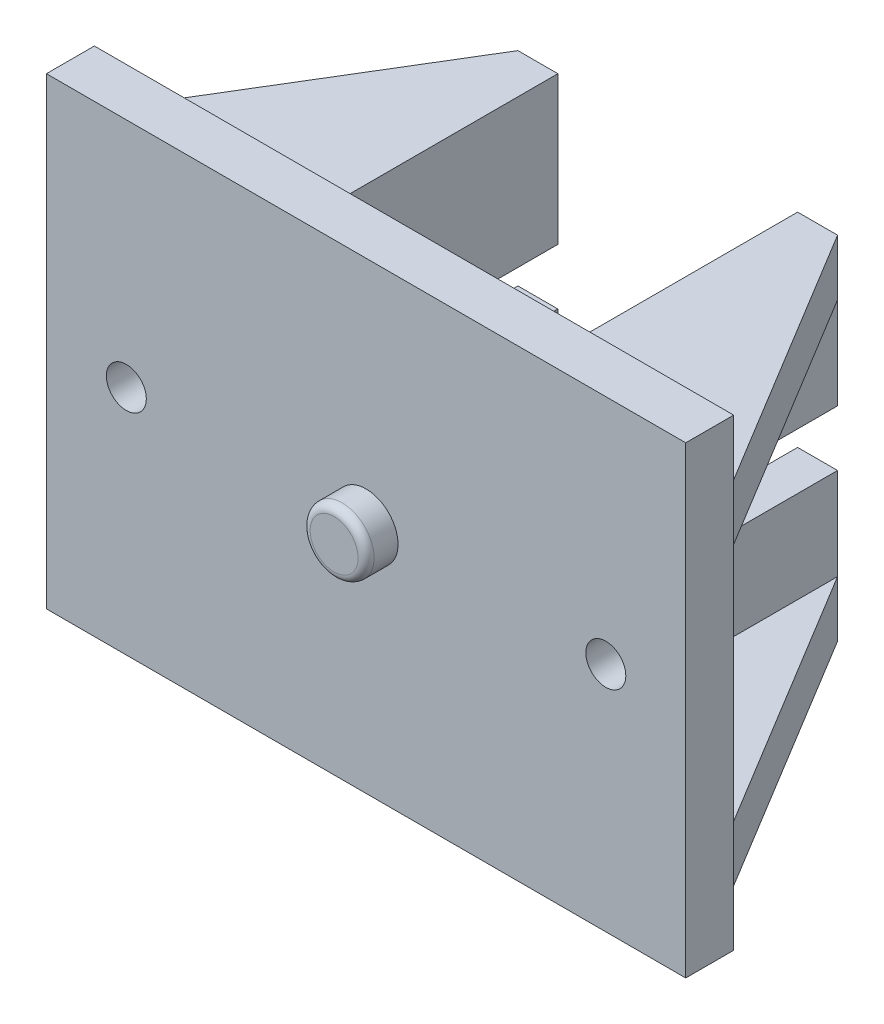
from build123d import *

# Parameters (mm, degrees)
SKETCH_2_W               = 80
SKETCH_2_H               = 58
SKETCH_2_R               = 2.5
EXTRUDE_1_DEPTH          = 6
SKETCH_3_W               = 5
SKETCH_3_H               = 44
EXTRUDE_2_DEPTH          = 33
CUT_EXTRUDE_1_DEPTH      = 75.36396977
CUT_EXTRUDE_1_DEPTH_BACK = 75.36396977
SKETCH_12_R              = 4
EXTRUDE_3_DEPTH          = 4
RIB_10_REACH             = 70.007
SKETCH_13_WALL_W         = 176.60226785
SKETCH_13_WALL_H         = 7
RIB_12_REACH             = 70.007
SKETCH_16_WALL_W         = 176.60226785
SKETCH_16_WALL_H         = 7
FILLET_2_R               = 1


with BuildPart() as part:
    # 스케치2 → 보스-돌출1 (new body)
    with BuildSketch(Plane.XY):
        Rectangle(SKETCH_2_W, SKETCH_2_H)
        with Locations((-30, 0)):
            Circle(SKETCH_2_R, mode=Mode.SUBTRACT)
        with Locations((30, 0)):
            Circle(SKETCH_2_R, mode=Mode.SUBTRACT)
    extrude(amount=EXTRUDE_1_DEPTH)

    # 스케치3 → 보스-돌출2 (add)
    with BuildSketch(Plane(origin=(0, 0, 0), x_dir=(-1, 0, 0), z_dir=(0, 0, -1))):
        with Locations((-17.5, 0)):
            Rectangle(SKETCH_3_W, SKETCH_3_H)
        with Locations((17.5, 0)):
            Rectangle(SKETCH_3_W, SKETCH_3_H)
    extrude(amount=EXTRUDE_2_DEPTH)

    # 스케치11 → 컷-돌출1 (cut, two sides: drawn at the far end of the back side and taken through both)
    with BuildSketch(Plane(origin=(20, 0, 0), x_dir=(0, 0, -1), z_dir=(1, 0, 0)).offset(-CUT_EXTRUDE_1_DEPTH_BACK)):
        with BuildLine():
            Line((33, -3.5), (11, -3.5))
            ThreePointArc((11, -3.5), (8.878679656, -2.621320344), (8, -0.5))
            Line((8, -0.5), (8, 0.5))
            ThreePointArc((8, 0.5), (8.878679656, 2.621320344), (11, 3.5))
            Line((11, 3.5), (33, 3.5))
            Line((33, 3.5), (33, -3.5))
        make_face()
    extrude(amount=CUT_EXTRUDE_1_DEPTH + CUT_EXTRUDE_1_DEPTH_BACK, mode=Mode.SUBTRACT)

    # 스케치12 → 보스-돌출3 (add)
    with BuildSketch(Plane.XY.offset(6)):
        with Locations(Location((0, 0, 0), (0, 0, 180))):
            Circle(SKETCH_12_R)
    extrude(amount=EXTRUDE_3_DEPTH)

    # 스케치13 wall → 보강대10 (add, up to next)
    with BuildSketch(Plane(origin=(-30, 15, -16.5), x_dir=(-0.518301716093, 0, 0.855197831554), z_dir=(0.855197831554, 0, 0.518301716093)), mode=Mode.PRIVATE) as rib_10_sk1:
        with Locations((0, -3.5)):
            Rectangle(SKETCH_13_WALL_W, SKETCH_13_WALL_H)
    rib_10_tool1 = extrude(rib_10_sk1.sketch, amount=RIB_10_REACH, mode=Mode.PRIVATE) - part.part
    rib_10 = rib_10_tool1.solids().sort_by_distance((-30, 15, -16.5))[0]
    add(rib_10)

    # 스케치16 wall → 보강대12 (add, up to next)
    with BuildSketch(Plane(origin=(-30, -15, -16.5), x_dir=(-0.518301716093, 0, 0.855197831554), z_dir=(0.855197831554, 0, 0.518301716093)), mode=Mode.PRIVATE) as rib_12_sk1:
        with Locations((0, 3.5)):
            Rectangle(SKETCH_16_WALL_W, SKETCH_16_WALL_H)
    rib_12_tool1 = extrude(rib_12_sk1.sketch, amount=RIB_12_REACH, mode=Mode.PRIVATE) - part.part
    rib_12 = rib_12_tool1.solids().sort_by_distance((-30, -15, -16.5))[0]
    add(rib_12)

    # 대칭 복사1: 보강대10 across plane
    add(rib_10.mirror(Plane(origin=(0, 0, 0), x_dir=(0, 0, 1), z_dir=(1, 0, 0))))

    # 대칭 복사2: 보강대12 across plane
    add(rib_12.mirror(Plane(origin=(0, 0, 0), x_dir=(0, 0, 1), z_dir=(1, 0, 0))))

    # 필렛2
    fillet_2_edges = [part.edges().sort_by_distance(p)[0] for p in [
        (4, 0, 10),
    ]]
    fillet(fillet_2_edges, radius=FILLET_2_R)


solid = part.part
